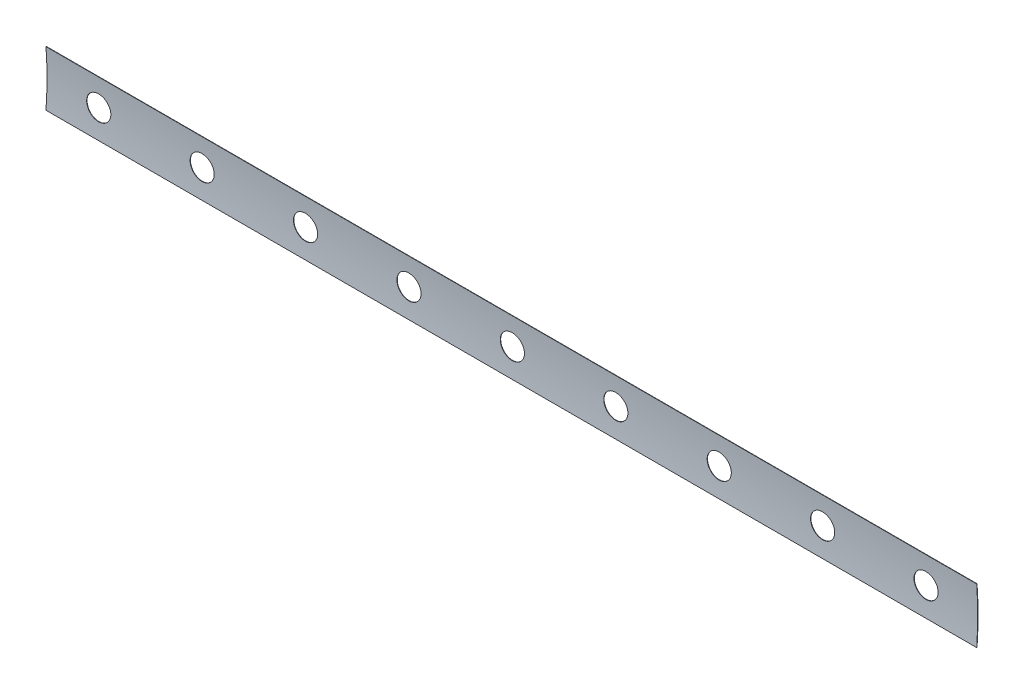
from build123d import *

# Parameters (mm, degrees)
BOSS_EXTRUDE1_DEPTH = 1350
SKETCH2_R           = 17.5
CUT_EXTRUDE1_DEPTH  = 1352.586120031
LPATTERN1_COUNT     = 9
LPATTERN1_PITCH     = 150


with BuildPart() as part:
    # Sketch1 → Boss-Extrude1 (new body)
    with BuildSketch(Plane(origin=(0, 0, 0), x_dir=(0, 0, -1), z_dir=(1, 0, 0))):
        with BuildLine():
            Line((-44.141451969, 32.198077043), (-44.64, 32.16))
            ThreePointArc((-44.64, 32.16), (-43.114703605, -7.84), (-44.64, -47.84))
            Line((-44.64, -47.84), (-44.141451969, -47.878077043))
            ThreePointArc((-44.141451969, -47.878077043), (-42.614703605, -7.84), (-44.141451969, 32.198077043))
        make_face()
    extrude(amount=BOSS_EXTRUDE1_DEPTH)

    # Sketch2 → Cut-Extrude1 (cut, symmetric)
    with BuildSketch(Plane.XY):
        with Locations(Location((75, -7.84, 0), (0, 0, 180))):
            Circle(SKETCH2_R)
    cut_extrude1 = extrude(amount=CUT_EXTRUDE1_DEPTH, both=True, mode=Mode.SUBTRACT)

    # LPattern1: Cut-Extrude1 ×9
    with Locations(*[(i * LPATTERN1_PITCH, 0, 0) for i in range(1, LPATTERN1_COUNT)]):
        add(cut_extrude1, mode=Mode.SUBTRACT)


solid = part.part
